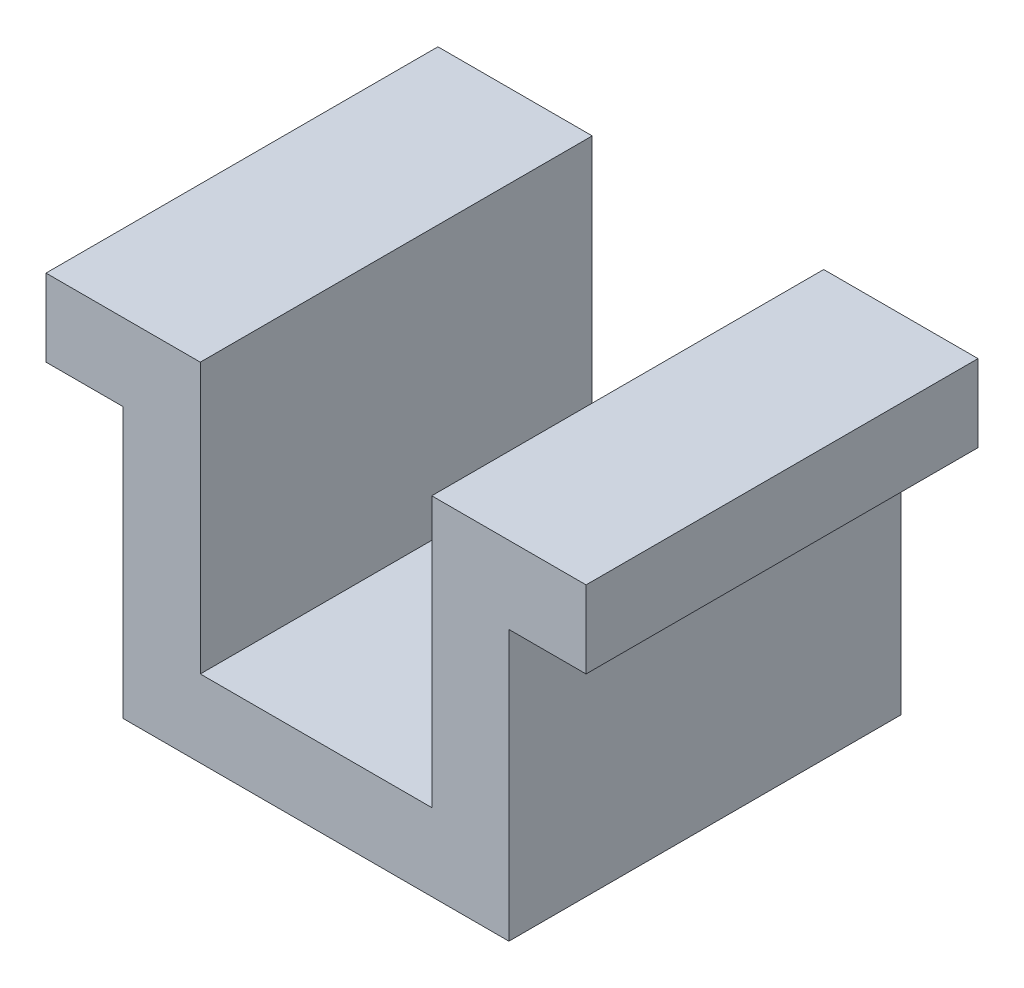
from build123d import *

# Parameters (mm, degrees)
EXTRUIR_L_MINA1_DEPTH = 25.4
CROQUIS2_R            = 4.7625
CORTAR_EXTRUIR1_DEPTH = 74.960530014


with BuildPart() as part:
    # Croquis1 → Extruir-Lámina1 (new, symmetric)
    with BuildSketch(Plane.XY):
        Polygon((-10, 35), (0, 35), (0, 0), (50, 0), (50, 35), (60, 35), (60, 45), (40, 45), (40, 10), (10, 10), (10, 45), (-10, 45), align=None)
    extrude(amount=EXTRUIR_L_MINA1_DEPTH, both=True)

    # Croquis2 → Cortar-Extruir1 (cut, through all)
    with BuildSketch(Plane(origin=(0, 10, 0), x_dir=(1, 0, 0), z_dir=(0, 1, 0))):
        with Locations(Location((25, 0, 0), (0, 0, 270))):
            Circle(CROQUIS2_R)
    extrude(amount=-CORTAR_EXTRUIR1_DEPTH, mode=Mode.SUBTRACT)


solid = part.part
